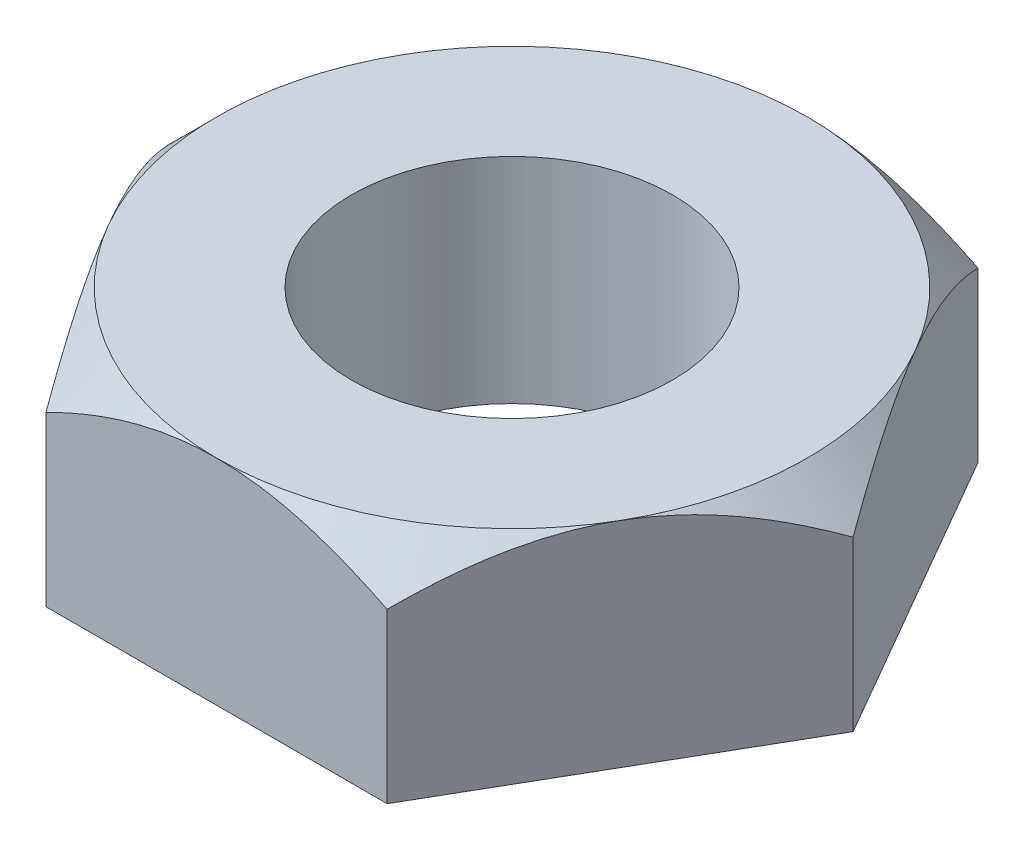
from build123d import *

# Parameters (mm, degrees)
SKETCH1_R           = 18.75
BOSS_EXTRUDE1_DEPTH = 12.5
SKETCH2_OUTSIDE_W   = 221.996
SKETCH2_OUTSIDE_H   = 211.322
SKETCH2_OUTSIDE_R   = 34.5
CUT_EXTRUDE1_DEPTH  = 59.328809348
CUT_EXTRUDE1_DRAFT  = -45


with BuildPart() as part:
    # Sketch1 → Boss-Extrude1 (new, symmetric)
    with BuildSketch(Plane(origin=(0, 0, 0), x_dir=(1, 0, 0), z_dir=(0, 1, 0))):
        Polygon((39.837168574, 0), (19.918584287, 34.5), (-19.918584287, 34.5), (-39.837168574, 0), (-19.918584287, -34.5), (19.918584287, -34.5), align=None)
        with Locations(Location((0, 0, 0), (0, 0, 270))):
            Circle(SKETCH1_R, mode=Mode.SUBTRACT)
    extrude(amount=BOSS_EXTRUDE1_DEPTH, both=True)


with BuildPart() as cut_extrude1_tool:
    # Sketch2 outside → Cut-Extrude1 (with draft: the straight prism first)
    with BuildSketch(Plane(origin=(0, 12.5, 0), x_dir=(1, 0, 0), z_dir=(0, 1, 0))):
        Rectangle(SKETCH2_OUTSIDE_W, SKETCH2_OUTSIDE_H)
        Circle(SKETCH2_OUTSIDE_R, mode=Mode.SUBTRACT)
    extrude(amount=-CUT_EXTRUDE1_DEPTH)
    # Cut-Extrude1: the draft: its side faces are tilted about the plane it starts from
    cut_extrude1_sides = [cut_extrude1_tool.faces().sort_by_distance(p)[0] for p in [
        (0, -17.164404674, 105.661),
        (110.998, -17.164404674, 0),
        (0, -17.164404674, -105.661),
        (-110.998, -17.164404674, 0),
        (-34.5, -17.164404674, 0),
    ]]
    draft(cut_extrude1_sides, Plane(origin=(0, 12.5, 0), x_dir=(1, 0, 0), z_dir=(0, 1, 0)), CUT_EXTRUDE1_DRAFT)


with BuildPart() as part_1:
    add(part.part)

    # Cut-Extrude1: cut by cut_extrude1_tool
    add(cut_extrude1_tool.part, mode=Mode.SUBTRACT)


solid = part_1.part
